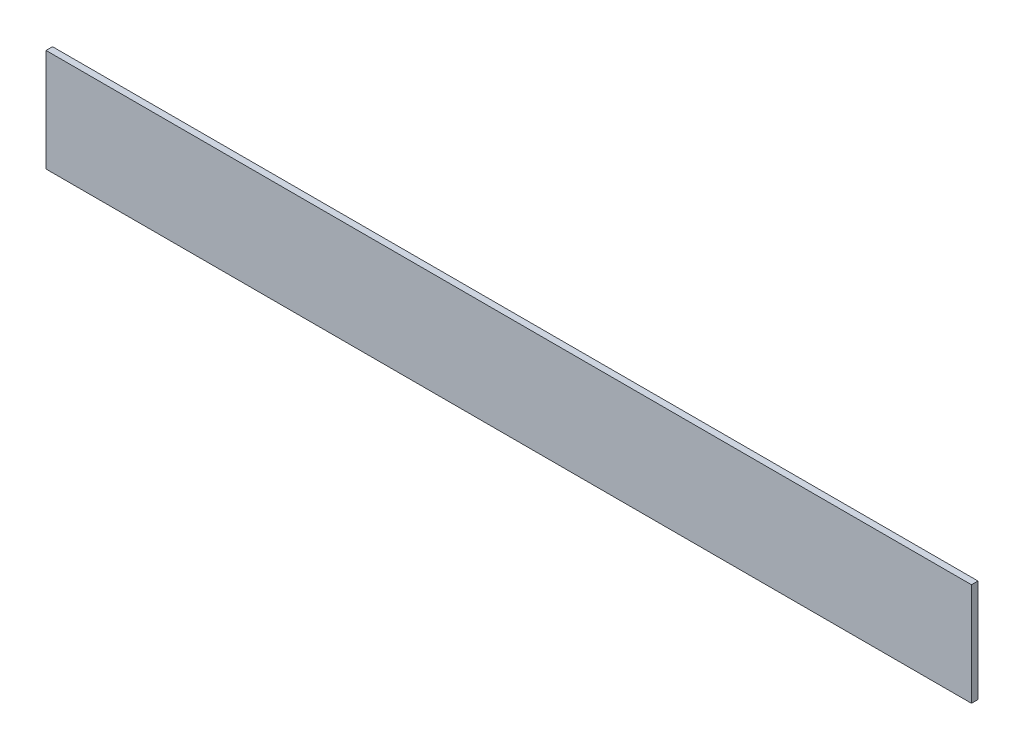
from build123d import *

# Parameters (mm, degrees)
SKETCH1_W           = 450.87
SKETCH1_H           = 50.038
BOSS_EXTRUDE1_DEPTH = 3.175


with BuildPart() as part:
    # Sketch1 → Boss-Extrude1 (new body)
    with BuildSketch(Plane.XY):
        Rectangle(SKETCH1_W, SKETCH1_H)
    extrude(amount=BOSS_EXTRUDE1_DEPTH)


solid = part.part
